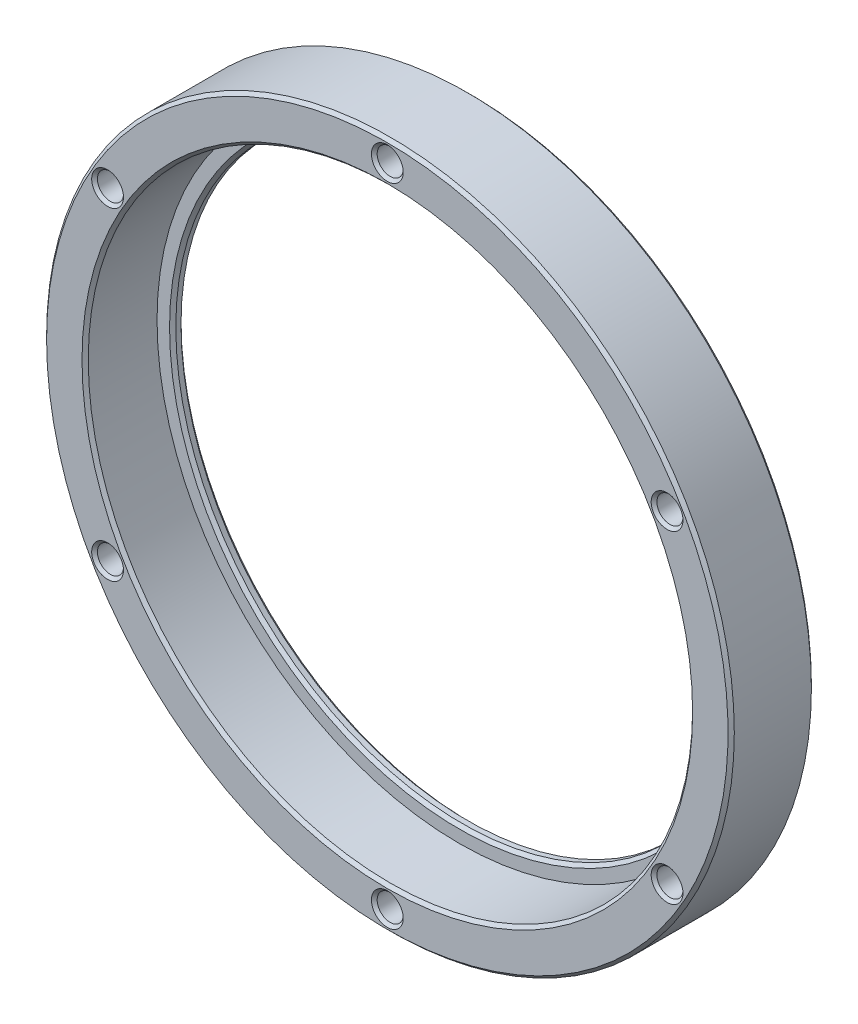
from build123d import *

# Parameters (mm, degrees)
PATTERN_CIRCULAR_1_COUNT = 6
CHAMFER_1_SIZE           = 0.3


with BuildPart() as part:
    # 草图1 → 旋转1 (revolve)
    with BuildSketch(Plane(origin=(0, 0, 0), x_dir=(1, 0, 0), z_dir=(0, 1, 0)), mode=Mode.PRIVATE) as revolve_1_sk:
        Polygon((27.5, 0), (33, 0), (33, -8), (29, -8), (29, -1.1), (27.5, -1.1), align=None)
    revolve(revolve_1_sk.sketch.rotate(Axis((0, 0, 0), (0, 0, 1)), 180), axis=Axis((0, 0, 0), (0, 0, 1)))

    # 草图3 → M3 螺纹孔1 (revolve, cut)
    with BuildSketch(Plane(origin=(0, 31, 8), x_dir=(0, -1, 0), z_dir=(1, 0, 0))):
        Polygon((0, 0), (0, 8), (1.525, 8), (1.25, 7.725), (1.25, 0.275), (1.525, 0), align=None)
    hole_wizard_m3_1 = revolve(axis=Axis((0, 31, 14.35), (0, 0, -1)), mode=Mode.SUBTRACT)

    # 阵列(圆周)1: M3 螺纹孔1 ×6 about axis
    pattern_circular_1_axis = Axis((0, 0, 0), (0, 0, 1))
    for i in range(1, PATTERN_CIRCULAR_1_COUNT):
        add(hole_wizard_m3_1.rotate(pattern_circular_1_axis, i * 360 / PATTERN_CIRCULAR_1_COUNT), mode=Mode.SUBTRACT)

    # 倒角1
    chamfer_1_edges = [part.edges().sort_by_distance(p)[0] for p in [
        (27.5, 0, 1.1),
        (29, 0, 8),
        (33, 0, 8),
        (33, 0, 0),
        (27.5, 0, 0),
    ]]
    chamfer(chamfer_1_edges, length=CHAMFER_1_SIZE)


solid = part.part
